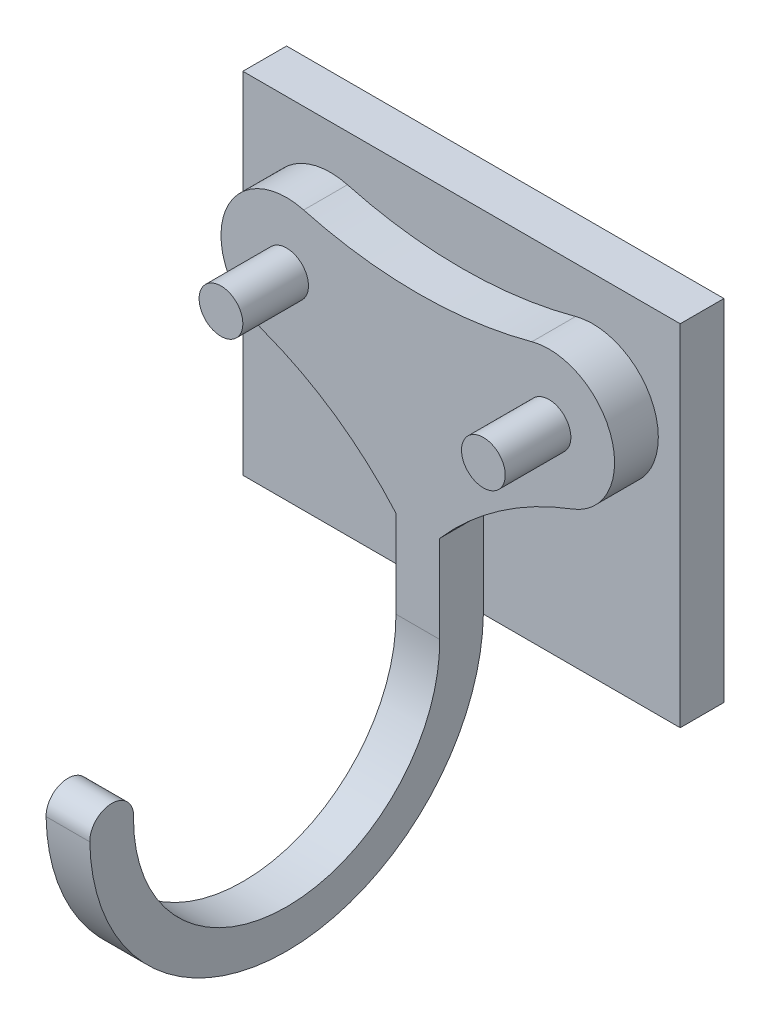
from build123d import *

# Parameters (mm, degrees)
CROQUIS2_W                   = 20
CROQUIS2_H                   = 16
SALIENTE_EXTRUIR1_DEPTH      = 2
SALIENTE_EXTRUIR2_DEPTH      = 2
CROQUIS4_R                   = 1
SALIENTE_EXTRUIR3_DEPTH      = 3
SALIENTE_EXTRUIR4_DEPTH      = 1
SALIENTE_EXTRUIR4_DEPTH_BACK = 1


with BuildPart() as part:
    # Croquis2 → Saliente-Extruir1 (new body)
    with BuildSketch(Plane.XY):
        Rectangle(CROQUIS2_W, CROQUIS2_H)
    extrude(amount=SALIENTE_EXTRUIR1_DEPTH)

    # Croquis3 → Saliente-Extruir2 (add)
    with BuildSketch(Plane.XY.offset(2)):
        with BuildLine():
            Line((1, -8), (1, -4))
            ThreePointArc((1, -4), (3.764366067, -1.528144202), (7.050666594, 0.190000052))
            ThreePointArc((7.050666594, 0.190000052), (8.85620748, 3.917648534), (5.217391304, 5.896122171))
            ThreePointArc((5.217391304, 5.896122171), (0, 5.203603311), (-5.217391304, 5.896122171))
            ThreePointArc((-5.217391304, 5.896122171), (-8.85620748, 3.917648534), (-7.050666594, 0.190000052))
            ThreePointArc((-7.050666594, 0.190000052), (-3.764366067, -1.528144202), (-1, -4))
            Line((-1, -4), (-1, -8))
            Line((-1, -8), (1, -8))
        make_face()
    extrude(amount=SALIENTE_EXTRUIR2_DEPTH)

    # Croquis4 → Saliente-Extruir3 (add)
    with BuildSketch(Plane.XY.offset(4)):
        with Locations((-6, 3)):
            Circle(CROQUIS4_R)
        with Locations(Location((6, 3, 0), (0, 0, 180))):
            Circle(CROQUIS4_R)
    extrude(amount=SALIENTE_EXTRUIR3_DEPTH)

    # Croquis5 → Saliente-Extruir4 (add, two sides: drawn at the far end of the back side and taken through both)
    with BuildSketch(Plane(origin=(0, 0, 0), x_dir=(0, 0, -1), z_dir=(1, 0, 0)).offset(-SALIENTE_EXTRUIR4_DEPTH_BACK)):
        with BuildLine():
            Line((-4, -8), (-2.00123418, -8))
            ThreePointArc((-2.00123418, -8), (-10.990655722, -16.850952462), (-19.998436931, -8.018685662))
            ThreePointArc((-19.998436931, -8.018685662), (-18.950438256, -6.998395625), (-17.99933798, -8.109566741))
            ThreePointArc((-17.99933798, -8.109566741), (-10.94456846, -15.094975828), (-4, -8))
        make_face()
    extrude(amount=SALIENTE_EXTRUIR4_DEPTH + SALIENTE_EXTRUIR4_DEPTH_BACK)


solid = part.part
